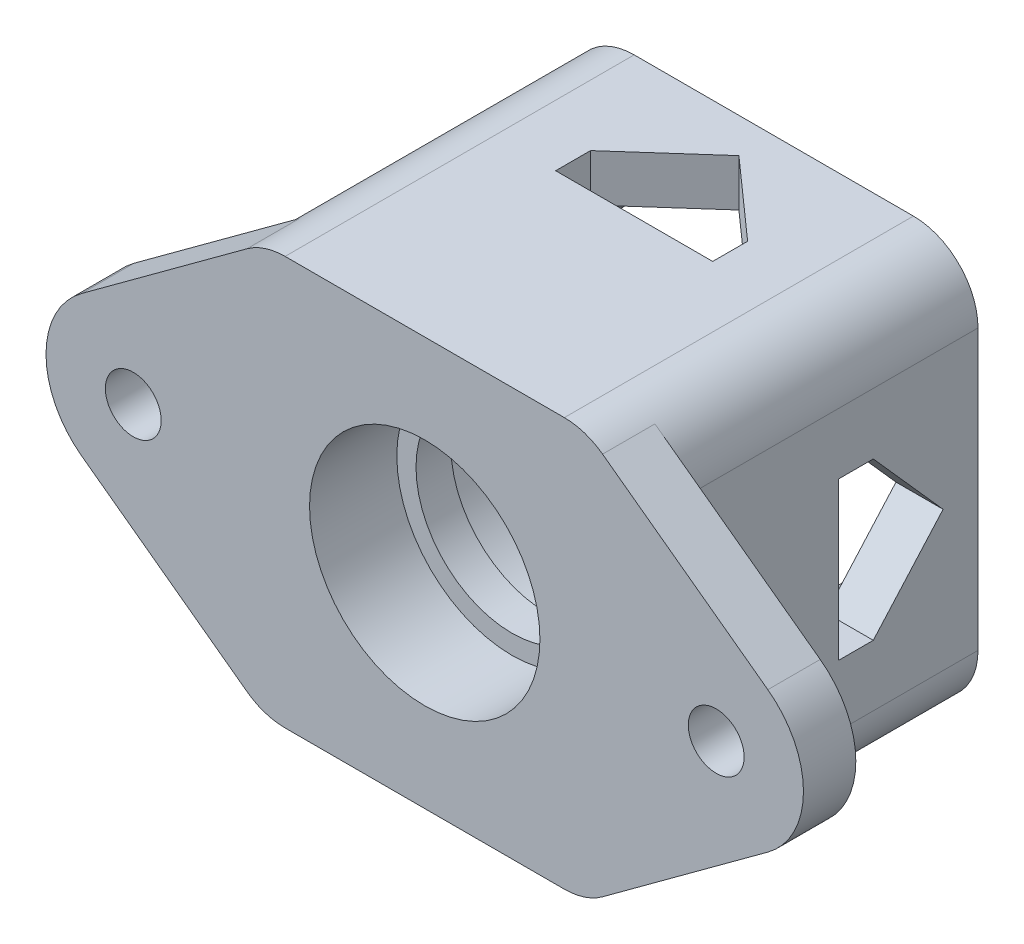
from build123d import *

# Parameters (mm, degrees)
SKETCH1_R               = 1.5
BOSS_EXTRUDE1_DEPTH     = 8
SKETCH2_R               = 5.5
BOSS_EXTRUDE2_DEPTH     = 7
SKETCH3_R               = 6.6
BOSS_EXTRUDE3_DEPTH     = 5
CUT_EXTRUDE2_DEPTH      = 33.930988446
SKETCH6_R               = 6.6
CUT_EXTRUDE3_DEPTH      = 5
BOSS_EXTRUDE4_START     = -3
SKETCH7_R               = 1.6
BOSS_EXTRUDE4_DEPTH     = 3
CIRPATTERN1_COUNT       = 2
CIRPATTERN1_ANGLE       = 90
CUT_EXTRUDE_THIN1_REACH = 33.746


with BuildPart() as part:
    # Sketch1 → Boss-Extrude1 (new body)
    with BuildSketch(Plane.XY):
        with BuildLine():
            ThreePointArc((-11.7, -8), (-10.61629509, -10.61629509), (-8, -11.7))
            Line((-8, -11.7), (8, -11.7))
            ThreePointArc((8, -11.7), (10.61629509, -10.61629509), (11.7, -8))
            Line((11.7, -8), (11.7, 8))
            ThreePointArc((11.7, 8), (10.61629509, 10.61629509), (8, 11.7))
            Line((8, 11.7), (-8, 11.7))
            ThreePointArc((-8, 11.7), (-10.61629509, 10.61629509), (-11.7, 8))
            Line((-11.7, 8), (-11.7, -8))
        make_face()
        with Locations((-8, 8)):
            Circle(SKETCH1_R, mode=Mode.SUBTRACT)
        with BuildLine():
            ThreePointArc((-8, 4.5), (-5.525126266, 5.525126266), (-4.5, 8))
            Line((-4.5, 8), (4.5, 8))
            ThreePointArc((4.5, 8), (5.525126266, 5.525126266), (8, 4.5))
            Line((8, 4.5), (8, -4.5))
            ThreePointArc((8, -4.5), (5.525126266, -5.525126266), (4.5, -8))
            Line((4.5, -8), (-4.5, -8))
            ThreePointArc((-4.5, -8), (-5.525126266, -5.525126266), (-8, -4.5))
            Line((-8, -4.5), (-8, 4.5))
        make_face(mode=Mode.SUBTRACT)
        with Locations((8, -8)):
            Circle(SKETCH1_R, mode=Mode.SUBTRACT)
        with Locations((-8, -8)):
            Circle(SKETCH1_R, mode=Mode.SUBTRACT)
        with Locations((8, 8)):
            Circle(SKETCH1_R, mode=Mode.SUBTRACT)
    extrude(amount=BOSS_EXTRUDE1_DEPTH)

    # Sketch2 → Boss-Extrude2 (add)
    with BuildSketch(Plane.XY.offset(8)):
        with BuildLine():
            Line((8, 11.7), (-8, 11.7))
            ThreePointArc((-8, 11.7), (-10.61629509, 10.61629509), (-11.7, 8))
            Line((-11.7, 8), (-11.7, -8))
            ThreePointArc((-11.7, -8), (-10.61629509, -10.61629509), (-8, -11.7))
            Line((-8, -11.7), (8, -11.7))
            ThreePointArc((8, -11.7), (10.61629509, -10.61629509), (11.7, -8))
            Line((11.7, -8), (11.7, 8))
            ThreePointArc((11.7, 8), (10.61629509, 10.61629509), (8, 11.7))
        make_face()
        Circle(SKETCH2_R, mode=Mode.SUBTRACT)
    extrude(amount=BOSS_EXTRUDE2_DEPTH)

    # Sketch3 → Boss-Extrude3 (add)
    with BuildSketch(Plane.XY.offset(15)):
        with BuildLine():
            Line((8, 11.7), (-8, 11.7))
            ThreePointArc((-8, 11.7), (-10.61629509, 10.61629509), (-11.7, 8))
            Line((-11.7, 8), (-11.7, -8))
            ThreePointArc((-11.7, -8), (-10.61629509, -10.61629509), (-8, -11.7))
            Line((-8, -11.7), (8, -11.7))
            ThreePointArc((8, -11.7), (10.61629509, -10.61629509), (11.7, -8))
            Line((11.7, -8), (11.7, 8))
            ThreePointArc((11.7, 8), (10.61629509, 10.61629509), (8, 11.7))
        make_face()
        Circle(SKETCH3_R, mode=Mode.SUBTRACT)
    extrude(amount=BOSS_EXTRUDE3_DEPTH)

    # Sketch5 → Cut-Extrude2 (cut, through all)
    with BuildSketch(Plane.XZ.offset(11.7)):
        Polygon((-4.5, 6), (0, 2), (4.5, 6), (4.5, 8), (-4.5, 8), align=None)
    cut_extrude2 = extrude(amount=-CUT_EXTRUDE2_DEPTH, mode=Mode.SUBTRACT)

    # Sketch6 → Cut-Extrude3 (cut)
    with BuildSketch(Plane(origin=(0, 0, 8), x_dir=(-1, 0, 0), z_dir=(0, 0, -1))):
        with Locations(Location((0, 0, 0), (0, 0, 180))):
            Circle(SKETCH6_R)
    extrude(amount=-CUT_EXTRUDE3_DEPTH, mode=Mode.SUBTRACT)

    # Sketch7 → Boss-Extrude4 (add)
    # profile 1 of 2: a face of its own
    with BuildSketch(Plane.XY.offset(20).offset(BOSS_EXTRUDE4_START)):
        with BuildLine():
            Line((19.659006407, 4.030419467), (10.189664741, 10.982510406))
            ThreePointArc((10.189664741, 10.982510406), (11.300890754, 9.671562212), (11.7, 8))
            Line((11.7, 8), (11.7, -8))
            ThreePointArc((11.7, -8), (11.300890754, -9.671562212), (10.189664741, -10.982510406))
            Line((10.189664741, -10.982510406), (19.659006407, -4.030419467))
            ThreePointArc((19.659006407, -4.030419467), (21.7, 0), (19.659006407, 4.030419467))
        make_face()
        with Locations((16.7, 0)):
            Circle(SKETCH7_R, mode=Mode.SUBTRACT)
    # profile 2 of 2: a face of its own
    with BuildSketch(Plane.XY.offset(20).offset(BOSS_EXTRUDE4_START)):
        with BuildLine():
            Line((-11.7, -8), (-11.7, 8))
            ThreePointArc((-11.7, 8), (-11.300890754, 9.671562212), (-10.189664741, 10.982510406))
            Line((-10.189664741, 10.982510406), (-19.659006407, 4.030419467))
            ThreePointArc((-19.659006407, 4.030419467), (-21.7, 0), (-19.659006407, -4.030419467))
            Line((-19.659006407, -4.030419467), (-10.189664741, -10.982510406))
            ThreePointArc((-10.189664741, -10.982510406), (-11.300890754, -9.671562212), (-11.7, -8))
        make_face()
        with Locations(Location((-16.7, 0, 0), (0, 0, 180))):
            Circle(SKETCH7_R, mode=Mode.SUBTRACT)
    extrude(amount=BOSS_EXTRUDE4_DEPTH)

    # CirPattern1: Cut-Extrude2 ×2 about axis
    cirpattern1_axis = Axis((0, 0, 8), (0, 0, -1))
    for i in range(1, CIRPATTERN1_COUNT):
        add(cut_extrude2.rotate(cirpattern1_axis, i * CIRPATTERN1_ANGLE / (CIRPATTERN1_COUNT - 1)), mode=Mode.SUBTRACT)

    # Cut-Extrude-Thin1: up to this face of the body (flat: up to its plane)
    cut_extrude_thin1_end = Plane(part.part.faces().sort_by_distance((-11.369074026, 0, 8))[0])
    # Sketch8 → Cut-Extrude-Thin1 (cut, up to the picked face)
    with BuildSketch(Plane(origin=(0, 0, 0), x_dir=(-1, 0, 0), z_dir=(0, 0, -1)), mode=Mode.PRIVATE) as cut_extrude_thin1_sk1:
        with BuildLine():
            Line((5.708712153, 9), (-5.708712153, 9))
            ThreePointArc((-5.708712153, 9), (-6.232233047, 6.232233047), (-9, 5.708712153))
            Line((-9, 5.708712153), (-9, -5.708712153))
            ThreePointArc((-9, -5.708712153), (-6.232233047, -6.232233047), (-5.708712153, -9))
            Line((-5.708712153, -9), (5.708712153, -9))
            ThreePointArc((5.708712153, -9), (6.232233047, -6.232233047), (9, -5.708712153))
            Line((9, -5.708712153), (9, 5.708712153))
            ThreePointArc((9, 5.708712153), (6.232233047, 6.232233047), (5.708712153, 9))
        make_face()
        with BuildLine():
            Line((4.5, 8), (-4.5, 8))
            ThreePointArc((-4.5, 8), (-5.525126266, 5.525126266), (-8, 4.5))
            Line((-8, 4.5), (-8, -4.5))
            ThreePointArc((-8, -4.5), (-5.525126266, -5.525126266), (-4.5, -8))
            Line((-4.5, -8), (4.5, -8))
            ThreePointArc((4.5, -8), (5.525126266, -5.525126266), (8, -4.5))
            Line((8, -4.5), (8, 4.5))
            ThreePointArc((8, 4.5), (5.525126266, 5.525126266), (4.5, 8))
        make_face(mode=Mode.SUBTRACT)
    cut_extrude_thin1_tool1 = split(extrude(cut_extrude_thin1_sk1.sketch, amount=-CUT_EXTRUDE_THIN1_REACH, mode=Mode.PRIVATE), bisect_by=cut_extrude_thin1_end, keep=Keep.BOTH, mode=Mode.PRIVATE)
    add(cut_extrude_thin1_tool1.solids().sort_by(Axis((-6.052233, 6.052233, 0), (0, 0, 1)))[0], mode=Mode.SUBTRACT)


solid = part.part
